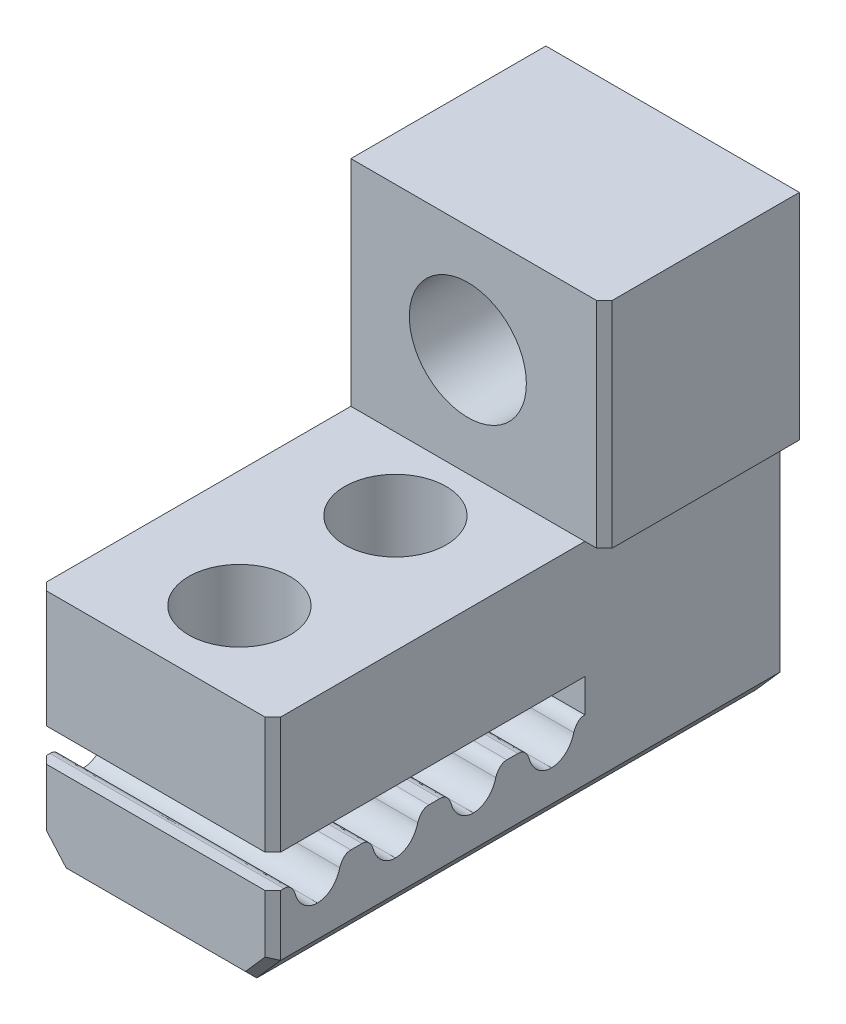
from build123d import *

# Parameters (mm, degrees)
BOSS_EXTRUDE1_DEPTH     = 13
SKETCH6_W               = 6
SKETCH6_H               = 5
BOSS_EXTRUDE4_DEPTH     = 5.6
SKETCH16_W              = 6
SKETCH16_H              = 8
BOSS_EXTRUDE5_DEPTH     = 0.1
CUT_EXTRUDE6_DEPTH      = 4
CUT_EXTRUDE6_DEPTH_BACK = 3.6
SKETCH15_R              = 1.3
CUT_EXTRUDE7_DEPTH      = 8.7202
CUT_EXTRUDE8_START      = -0.2202
SKETCH19_W              = 6
SKETCH19_H              = 8
SKETCH19_R              = 1.3
CUT_EXTRUDE8_DEPTH      = 0.2202
SKETCH12_R              = 1.5
CUT_EXTRUDE5_DEPTH      = 6
CHAMFER1_SIZE           = 0.2
SKETCH20_W              = 5
SKETCH20_H              = 5.5
BOSS_EXTRUDE6_DEPTH     = 0.5
SKETCH21_W              = 5
SKETCH21_H              = 5.5
BOSS_EXTRUDE7_DEPTH     = 0.5
CHAMFER2_SIZE           = 0.2
CROQUIS1_W              = 5
CROQUIS1_H              = 5.5
CORTAR_EXTRUIR1_DEPTH   = 0.5


with BuildPart() as part:
    # Sketch1 → Boss-Extrude1 (new body)
    with BuildSketch(Plane.XY):
        Polygon((3, 3.05), (3, -2.253801214), (2.388188946, -2.95), (-2.388188946, -2.95), (-3, -2.253801214), (-3, 3.05), align=None)
    extrude(amount=BOSS_EXTRUDE1_DEPTH)

    # Sketch6 → Boss-Extrude4 (add)
    with BuildSketch(Plane(origin=(0, 3.05, 0), x_dir=(1, 0, 0), z_dir=(0, 1, 0))):
        with Locations((0, -2.5)):
            Rectangle(SKETCH6_W, SKETCH6_H)
    extrude(amount=BOSS_EXTRUDE4_DEPTH)

    # Sketch16 → Boss-Extrude5 (add)
    with BuildSketch(Plane(origin=(0, 3.05, 0), x_dir=(1, 0, 0), z_dir=(0, 1, 0))):
        with Locations((0, -9)):
            Rectangle(SKETCH16_W, SKETCH16_H)
    extrude(amount=BOSS_EXTRUDE5_DEPTH)

    # Sketch18 → Cut-Extrude6 (cut, two sides: drawn at the far end of the back side and taken through both)
    with BuildSketch(Plane(origin=(0, 0, 0), x_dir=(0, 0, -1), z_dir=(1, 0, 0)).offset(-CUT_EXTRUDE6_DEPTH_BACK)):
        with BuildLine():
            Line((-8.8572, -0.0702), (-12.8572, -0.0702))
            Line((-12.8572, -0.0702), (-13, -0.0702))
            Line((-13, -0.0702), (-13, -0.7))
            Line((-13, -0.7), (-12.8572, -0.7))
            Line((-12.8572, -0.7), (-12.7144, -0.7))
            add(Edge.make_bspline(
                [(-12.7144, -0.7), (-12.5198, -0.7), (-12.43, -0.9509)],
                knots=[0.103448276, 0.103448276, 0.103448276, 0.137931034, 0.137931034, 0.137931034], degree=2))
            add(Edge.make_bspline(
                [(-12.43, -0.9509), (-12.3594, -1.2388), (-12.13, -1.45), (-11.8572, -1.45)],
                knots=[0.137931034, 0.137931034, 0.137931034, 0.137931034, 0.172413793, 0.172413793, 0.172413793, 0.172413793], degree=3))
            add(Edge.make_bspline(
                [(-11.8572, -1.45), (-11.5844, -1.45), (-11.355, -1.2388), (-11.2844, -0.9509)],
                knots=[0.172413793, 0.172413793, 0.172413793, 0.172413793, 0.206896552, 0.206896552, 0.206896552, 0.206896552], degree=3))
            add(Edge.make_bspline(
                [(-11.2844, -0.9509), (-11.1946, -0.7), (-11, -0.7)],
                knots=[0.206896552, 0.206896552, 0.206896552, 0.24137931, 0.24137931, 0.24137931], degree=2))
            Line((-11, -0.7), (-10.8572, -0.7))
            Line((-10.8572, -0.7), (-10.7144, -0.7))
            add(Edge.make_bspline(
                [(-10.7144, -0.7), (-10.5198, -0.7), (-10.43, -0.9509)],
                knots=[0.310344828, 0.310344828, 0.310344828, 0.344827586, 0.344827586, 0.344827586], degree=2))
            add(Edge.make_bspline(
                [(-10.43, -0.9509), (-10.3594, -1.2388), (-10.13, -1.45), (-9.8572, -1.45)],
                knots=[0.344827586, 0.344827586, 0.344827586, 0.344827586, 0.379310345, 0.379310345, 0.379310345, 0.379310345], degree=3))
            add(Edge.make_bspline(
                [(-9.8572, -1.45), (-9.5844, -1.45), (-9.355, -1.2388), (-9.2844, -0.9509)],
                knots=[0.379310345, 0.379310345, 0.379310345, 0.379310345, 0.413793103, 0.413793103, 0.413793103, 0.413793103], degree=3))
            add(Edge.make_bspline(
                [(-9.2844, -0.9509), (-9.1946, -0.7), (-9, -0.7)],
                knots=[0.413793103, 0.413793103, 0.413793103, 0.448275862, 0.448275862, 0.448275862], degree=2))
            Line((-9, -0.7), (-8.8572, -0.7))
            Line((-8.8572, -0.7), (-8.7144, -0.7))
            add(Edge.make_bspline(
                [(-8.7144, -0.7), (-8.5198, -0.7), (-8.43, -0.9509)],
                knots=[0.517241379, 0.517241379, 0.517241379, 0.551724138, 0.551724138, 0.551724138], degree=2))
            add(Edge.make_bspline(
                [(-8.43, -0.9509), (-8.3594, -1.2388), (-8.13, -1.45), (-7.8572, -1.45)],
                knots=[0.551724138, 0.551724138, 0.551724138, 0.551724138, 0.586206897, 0.586206897, 0.586206897, 0.586206897], degree=3))
            add(Edge.make_bspline(
                [(-7.8572, -1.45), (-7.5844, -1.45), (-7.355, -1.2388), (-7.2844, -0.9509)],
                knots=[0.586206897, 0.586206897, 0.586206897, 0.586206897, 0.620689655, 0.620689655, 0.620689655, 0.620689655], degree=3))
            add(Edge.make_bspline(
                [(-7.2844, -0.9509), (-7.1946, -0.7), (-7, -0.7)],
                knots=[0.620689655, 0.620689655, 0.620689655, 0.655172414, 0.655172414, 0.655172414], degree=2))
            Line((-7, -0.7), (-6.8572, -0.7))
            Line((-6.8572, -0.7), (-6.7144, -0.7))
            add(Edge.make_bspline(
                [(-6.7144, -0.7), (-6.5198, -0.7), (-6.43, -0.9509)],
                knots=[0.724137931, 0.724137931, 0.724137931, 0.75862069, 0.75862069, 0.75862069], degree=2))
            add(Edge.make_bspline(
                [(-6.43, -0.9509), (-6.3594, -1.2388), (-6.13, -1.45), (-5.8572, -1.45)],
                knots=[0.75862069, 0.75862069, 0.75862069, 0.75862069, 0.793103448, 0.793103448, 0.793103448, 0.793103448], degree=3))
            add(Edge.make_bspline(
                [(-5.8572, -1.45), (-5.5844, -1.45), (-5.355, -1.2388), (-5.2844, -0.9509)],
                knots=[0.793103448, 0.793103448, 0.793103448, 0.793103448, 0.827586207, 0.827586207, 0.827586207, 0.827586207], degree=3))
            add(Edge.make_bspline(
                [(-5.2844, -0.9509), (-5.1946, -0.7), (-5, -0.7)],
                knots=[0.827586207, 0.827586207, 0.827586207, 0.862068966, 0.862068966, 0.862068966], degree=2))
            Line((-5, -0.7), (-5, -0.0702))
            Line((-5, -0.0702), (-8.8572, -0.0702))
        make_face()
    extrude(amount=CUT_EXTRUDE6_DEPTH + CUT_EXTRUDE6_DEPTH_BACK, mode=Mode.SUBTRACT)

    # Sketch15 → Cut-Extrude7 (cut)
    with BuildSketch(Plane(origin=(0, 8.65, 0), x_dir=(1, 0, 0), z_dir=(0, 1, 0))):
        with Locations(Location((0, -10.8572, 0), (0, 0, 180))):
            Circle(SKETCH15_R)
        with Locations(Location((0, -6.8572, 0), (0, 0, 180))):
            Circle(SKETCH15_R)
    extrude(amount=-CUT_EXTRUDE7_DEPTH, mode=Mode.SUBTRACT)

    # Sketch19 → Cut-Extrude8 (cut)
    with BuildSketch(Plane.XZ.offset(0.0702).offset(CUT_EXTRUDE8_START)):
        with Locations((0, 9)):
            Rectangle(SKETCH19_W, SKETCH19_H)
        with Locations(Location((0, 10.8572, 0), (0, 0, 180))):
            Circle(SKETCH19_R, mode=Mode.SUBTRACT)
        with Locations(Location((0, 6.8572, 0), (0, 0, 180))):
            Circle(SKETCH19_R, mode=Mode.SUBTRACT)
    extrude(amount=CUT_EXTRUDE8_DEPTH, mode=Mode.SUBTRACT)

    # Sketch12 → Cut-Extrude5 (cut)
    with BuildSketch(Plane.XY.offset(5)):
        with Locations((0, 5.9)):
            Circle(SKETCH12_R)
    extrude(amount=-CUT_EXTRUDE5_DEPTH, mode=Mode.SUBTRACT)

    # Chamfer1
    chamfer1_edges = [part.edges().sort_by_distance(p)[0] for p in [
        (-2.694094473, -2.601900607, 13),
        (0, -2.95, 13),
        (2.694094473, -2.601900607, 13),
        (3, 1.65, 13),
        (3, -1.476900607, 13),
        (-3, -1.476900607, 13),
        (-3, 1.65, 13),
    ]]
    chamfer(chamfer1_edges, length=CHAMFER1_SIZE)

    # Sketch20 → Boss-Extrude6 (add)
    with BuildSketch(Plane(origin=(3, 0, 0), x_dir=(0, 0, -1), z_dir=(1, 0, 0))):
        with Locations((-2.5, 5.9)):
            Rectangle(SKETCH20_W, SKETCH20_H)
    extrude(amount=BOSS_EXTRUDE6_DEPTH)

    # Sketch21 → Boss-Extrude7 (add)
    with BuildSketch(Plane.ZY.offset(3)):
        with Locations((2.5, 5.9)):
            Rectangle(SKETCH21_W, SKETCH21_H)
    extrude(amount=BOSS_EXTRUDE7_DEPTH)

    # Chamfer2
    chamfer2_edges = [part.edges().sort_by_distance(p)[0] for p in [
        (3.5, 5.9, 5),
        (-3.5, 5.9, 5),
    ]]
    chamfer(chamfer2_edges, length=CHAMFER2_SIZE)

    # Croquis1 → Cortar-Extruir1 (cut)
    with BuildSketch(Plane.ZY.offset(3.5)):
        with Locations((2.5, 5.9)):
            Rectangle(CROQUIS1_W, CROQUIS1_H)
    extrude(amount=-CORTAR_EXTRUIR1_DEPTH, mode=Mode.SUBTRACT)


solid = part.part
